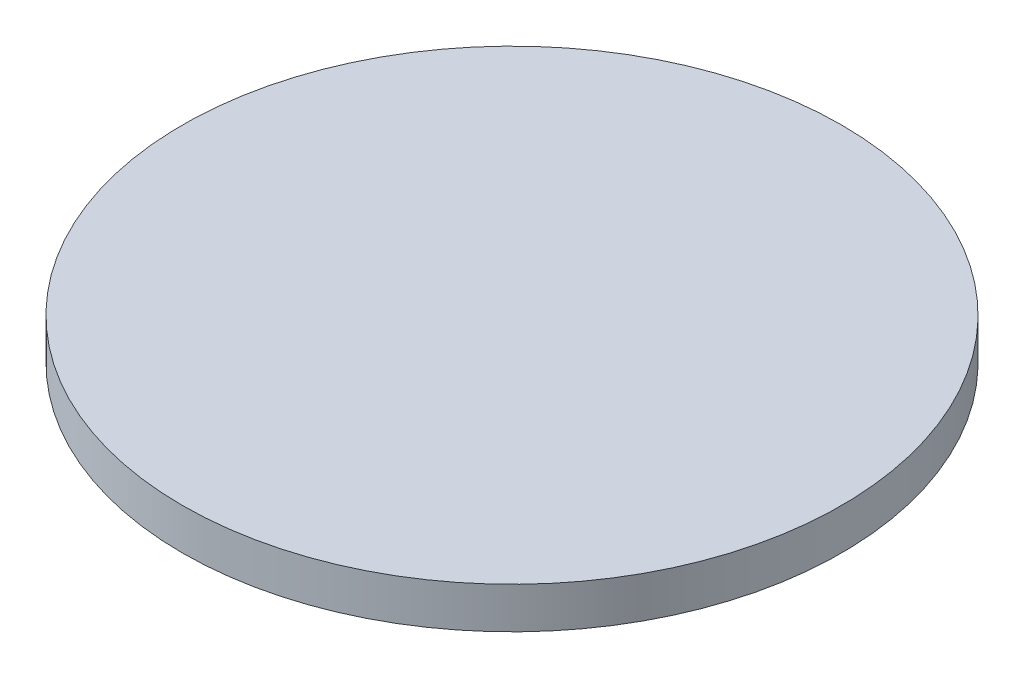
from build123d import *

# Parameters (mm, degrees)
SKETCH_1_R      = 12
EXTRUDE_1_DEPTH = 1.5


with BuildPart() as part:
    # Эскиз1 → Бобышка-Вытянуть1 (new body)
    with BuildSketch(Plane(origin=(0, 0, 0), x_dir=(1, 0, 0), z_dir=(0, 1, 0))):
        with Locations(Location((0, 0, 0), (0, 0, 270))):
            Circle(SKETCH_1_R)
    extrude(amount=EXTRUDE_1_DEPTH)


solid = part.part
